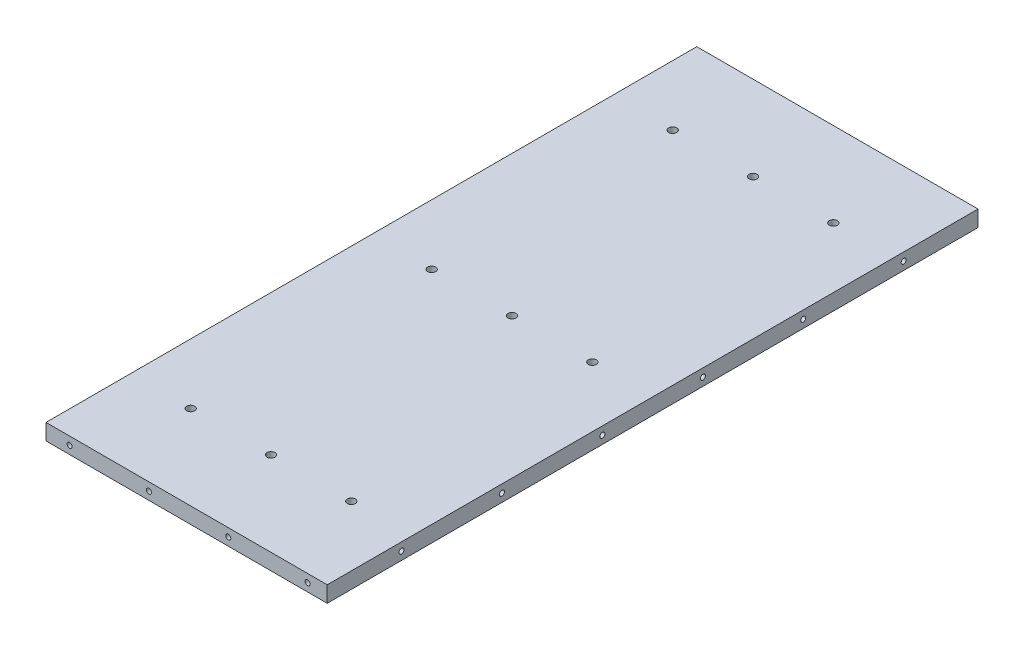
from build123d import *

# Parameters (mm, degrees)
SKETCH1_W                      = 140
SKETCH1_H                      = 324
BOSS_EXTRUDE1_DEPTH            = 8
M3X0_5_TAPPED_HOLE1_AT_2_COUNT = 2
M3X0_5_TAPPED_HOLE1_AT_2_PITCH = 39.5
M3X0_5_TAPPED_HOLE1_AT_3_COUNT = 2
M3X0_5_TAPPED_HOLE1_AT_3_PITCH = 79
M3X0_5_TAPPED_HOLE1_AT_4_COUNT = 2
M3X0_5_TAPPED_HOLE1_AT_4_PITCH = 118.5
M3X0_5_TAPPED_HOLE2_AT_2_COUNT = 2
M3X0_5_TAPPED_HOLE2_AT_2_PITCH = 50
M3X0_5_TAPPED_HOLE2_AT_3_COUNT = 2
M3X0_5_TAPPED_HOLE2_AT_3_PITCH = 100
M3X0_5_TAPPED_HOLE2_AT_4_COUNT = 2
M3X0_5_TAPPED_HOLE2_AT_4_PITCH = 150
M3X0_5_TAPPED_HOLE2_AT_5_COUNT = 2
M3X0_5_TAPPED_HOLE2_AT_5_PITCH = 200
M3X0_5_TAPPED_HOLE2_AT_6_COUNT = 2
M3X0_5_TAPPED_HOLE2_AT_6_PITCH = 250
LPATTERN1_COUNT                = 3
LPATTERN1_PITCH                = 40
LPATTERN1_COUNT_DIR2           = 2
LPATTERN1_PITCH_DIR2           = 120


with BuildPart() as part:
    # Sketch1 → Boss-Extrude1 (new body)
    with BuildSketch(Plane(origin=(0, 0, 0), x_dir=(1, 0, 0), z_dir=(0, 1, 0))):
        Rectangle(SKETCH1_W, SKETCH1_H)
    extrude(amount=BOSS_EXTRUDE1_DEPTH)

    # Sketch5 → M3x0.5 Tapped Hole1 (revolve, cut)
    with BuildSketch(Plane(origin=(60.25, 4, 162), x_dir=(0, -1, 0), z_dir=(1, 0, 0))):
        Polygon((0, 0), (0, 12.251075774), (1.25, 11.5), (1.25, 0), align=None)
    m3x0_5_tapped_hole1 = revolve(axis=Axis((60.25, 4, 168.35), (0, 0, -1)), mode=Mode.SUBTRACT)

    # M3x0.5 Tapped Hole1 at 2: M3x0.5 Tapped Hole1 ×2
    with Locations(*[(-i * M3X0_5_TAPPED_HOLE1_AT_2_PITCH, 0, 0) for i in range(1, M3X0_5_TAPPED_HOLE1_AT_2_COUNT)]):
        add(m3x0_5_tapped_hole1, mode=Mode.SUBTRACT)

    # M3x0.5 Tapped Hole1 at 3: M3x0.5 Tapped Hole1 ×2
    with Locations(*[(-i * M3X0_5_TAPPED_HOLE1_AT_3_PITCH, 0, 0) for i in range(1, M3X0_5_TAPPED_HOLE1_AT_3_COUNT)]):
        add(m3x0_5_tapped_hole1, mode=Mode.SUBTRACT)

    # M3x0.5 Tapped Hole1 at 4: M3x0.5 Tapped Hole1 ×2
    with Locations(*[(-i * M3X0_5_TAPPED_HOLE1_AT_4_PITCH, 0, 0) for i in range(1, M3X0_5_TAPPED_HOLE1_AT_4_COUNT)]):
        add(m3x0_5_tapped_hole1, mode=Mode.SUBTRACT)

    # Sketch7 → M3x0.5 Tapped Hole2 (revolve, cut)
    with BuildSketch(Plane(origin=(-70, 4, -125), x_dir=(0, 0, 1), z_dir=(0, 1, 0))):
        Polygon((0, 0), (0, 12.251075774), (1.25, 11.5), (1.25, 0), align=None)
    m3x0_5_tapped_hole2 = revolve(axis=Axis((-76.35, 4, -125), (1, 0, 0)), mode=Mode.SUBTRACT)

    # M3x0.5 Tapped Hole2 at 2: M3x0.5 Tapped Hole2 ×2
    with Locations(*[(0, 0, i * M3X0_5_TAPPED_HOLE2_AT_2_PITCH) for i in range(1, M3X0_5_TAPPED_HOLE2_AT_2_COUNT)]):
        add(m3x0_5_tapped_hole2, mode=Mode.SUBTRACT)

    # M3x0.5 Tapped Hole2 at 3: M3x0.5 Tapped Hole2 ×2
    with Locations(*[(0, 0, i * M3X0_5_TAPPED_HOLE2_AT_3_PITCH) for i in range(1, M3X0_5_TAPPED_HOLE2_AT_3_COUNT)]):
        add(m3x0_5_tapped_hole2, mode=Mode.SUBTRACT)

    # M3x0.5 Tapped Hole2 at 4: M3x0.5 Tapped Hole2 ×2
    with Locations(*[(0, 0, i * M3X0_5_TAPPED_HOLE2_AT_4_PITCH) for i in range(1, M3X0_5_TAPPED_HOLE2_AT_4_COUNT)]):
        add(m3x0_5_tapped_hole2, mode=Mode.SUBTRACT)

    # M3x0.5 Tapped Hole2 at 5: M3x0.5 Tapped Hole2 ×2
    with Locations(*[(0, 0, i * M3X0_5_TAPPED_HOLE2_AT_5_PITCH) for i in range(1, M3X0_5_TAPPED_HOLE2_AT_5_COUNT)]):
        add(m3x0_5_tapped_hole2, mode=Mode.SUBTRACT)

    # M3x0.5 Tapped Hole2 at 6: M3x0.5 Tapped Hole2 ×2
    with Locations(*[(0, 0, i * M3X0_5_TAPPED_HOLE2_AT_6_PITCH) for i in range(1, M3X0_5_TAPPED_HOLE2_AT_6_COUNT)]):
        add(m3x0_5_tapped_hole2, mode=Mode.SUBTRACT)

    # Mirror1: M3x0.5 Tapped Hole1 across plane
    add(m3x0_5_tapped_hole1.mirror(Plane.XY), mode=Mode.SUBTRACT)

    # Mirror1 copy 1 sketch → Mirror1 copy 1 (revolve, cut)
    with BuildSketch(Plane(origin=(20.75, 4, -162), x_dir=(0, -1, 0), z_dir=(1, 0, 0))):
        Polygon((0, 0), (0, -12.251075774), (1.25, -11.5), (1.25, 0), align=None)
    revolve(axis=Axis((20.75, 4, -168.35), (0, 0, -1)), mode=Mode.SUBTRACT)

    # Mirror1 copy 2 sketch → Mirror1 copy 2 (revolve, cut)
    with BuildSketch(Plane(origin=(-18.75, 4, -162), x_dir=(0, -1, 0), z_dir=(1, 0, 0))):
        Polygon((0, 0), (0, -12.251075774), (1.25, -11.5), (1.25, 0), align=None)
    revolve(axis=Axis((-18.75, 4, -168.35), (0, 0, -1)), mode=Mode.SUBTRACT)

    # Mirror1 copy 3 sketch → Mirror1 copy 3 (revolve, cut)
    with BuildSketch(Plane(origin=(-58.25, 4, -162), x_dir=(0, -1, 0), z_dir=(1, 0, 0))):
        Polygon((0, 0), (0, -12.251075774), (1.25, -11.5), (1.25, 0), align=None)
    revolve(axis=Axis((-58.25, 4, -168.35), (0, 0, -1)), mode=Mode.SUBTRACT)

    # Mirror2: M3x0.5 Tapped Hole2 across plane
    add(m3x0_5_tapped_hole2.mirror(Plane(origin=(0, 0, 0), x_dir=(0, 0, 1), z_dir=(1, 0, 0))), mode=Mode.SUBTRACT)

    # Mirror2 copy 1 sketch → Mirror2 copy 1 (revolve, cut)
    with BuildSketch(Plane(origin=(70, 4, -75), x_dir=(0, 0, 1), z_dir=(0, 1, 0))):
        Polygon((0, 0), (0, -12.251075774), (1.25, -11.5), (1.25, 0), align=None)
    revolve(axis=Axis((76.35, 4, -75), (1, 0, 0)), mode=Mode.SUBTRACT)

    # Mirror2 copy 2 sketch → Mirror2 copy 2 (revolve, cut)
    with BuildSketch(Plane(origin=(70, 4, -25), x_dir=(0, 0, 1), z_dir=(0, 1, 0))):
        Polygon((0, 0), (0, -12.251075774), (1.25, -11.5), (1.25, 0), align=None)
    revolve(axis=Axis((76.35, 4, -25), (1, 0, 0)), mode=Mode.SUBTRACT)

    # Mirror2 copy 3 sketch → Mirror2 copy 3 (revolve, cut)
    with BuildSketch(Plane(origin=(70, 4, 25), x_dir=(0, 0, 1), z_dir=(0, 1, 0))):
        Polygon((0, 0), (0, -12.251075774), (1.25, -11.5), (1.25, 0), align=None)
    revolve(axis=Axis((76.35, 4, 25), (1, 0, 0)), mode=Mode.SUBTRACT)

    # Mirror2 copy 4 sketch → Mirror2 copy 4 (revolve, cut)
    with BuildSketch(Plane(origin=(70, 4, 75), x_dir=(0, 0, 1), z_dir=(0, 1, 0))):
        Polygon((0, 0), (0, -12.251075774), (1.25, -11.5), (1.25, 0), align=None)
    revolve(axis=Axis((76.35, 4, 75), (1, 0, 0)), mode=Mode.SUBTRACT)

    # Mirror2 copy 5 sketch → Mirror2 copy 5 (revolve, cut)
    with BuildSketch(Plane(origin=(70, 4, 125), x_dir=(0, 0, 1), z_dir=(0, 1, 0))):
        Polygon((0, 0), (0, -12.251075774), (1.25, -11.5), (1.25, 0), align=None)
    revolve(axis=Axis((76.35, 4, 125), (1, 0, 0)), mode=Mode.SUBTRACT)

    # Sketch9 → Ø4.0mm Dowel Hole1 (revolve, cut)
    with BuildSketch(Plane(origin=(-40, 8, 0), x_dir=(0, 0, 1), z_dir=(1, 0, 0))):
        Polygon((0, 0), (0, 11.201721238), (2, 10), (2, 0), align=None)
    f_4_0mm_dowel_hole1 = revolve(axis=Axis((-40, 14.35, 0), (0, -1, 0)), mode=Mode.SUBTRACT)

    # LPattern1: 4.0mm Dowel Hole1 3 × 2
    with Locations(*[(i * LPATTERN1_PITCH, 0, j * LPATTERN1_PITCH_DIR2) for i in range(LPATTERN1_COUNT) for j in range(LPATTERN1_COUNT_DIR2) if (i, j) != (0, 0)]):
        add(f_4_0mm_dowel_hole1, mode=Mode.SUBTRACT)

    # Mirror3 copy 1 sketch → Mirror3 copy 1 (revolve, cut)
    with BuildSketch(Plane(origin=(-40, 8, -120), x_dir=(0, 0, -1), z_dir=(1, 0, 0))):
        Polygon((0, 0), (0, -11.201721238), (2, -10), (2, 0), align=None)
    revolve(axis=Axis((-40, 14.35, -120), (0, 1, 0)), mode=Mode.SUBTRACT)

    # Mirror3 copy 2 sketch → Mirror3 copy 2 (revolve, cut)
    with BuildSketch(Plane(origin=(0, 8, 0), x_dir=(0, 0, -1), z_dir=(1, 0, 0))):
        Polygon((0, 0), (0, -11.201721238), (2, -10), (2, 0), align=None)
    revolve(axis=Axis((0, 14.35, 0), (0, 1, 0)), mode=Mode.SUBTRACT)

    # Mirror3 copy 3 sketch → Mirror3 copy 3 (revolve, cut)
    with BuildSketch(Plane(origin=(0, 8, -120), x_dir=(0, 0, -1), z_dir=(1, 0, 0))):
        Polygon((0, 0), (0, -11.201721238), (2, -10), (2, 0), align=None)
    revolve(axis=Axis((0, 14.35, -120), (0, 1, 0)), mode=Mode.SUBTRACT)

    # Mirror3 copy 4 sketch → Mirror3 copy 4 (revolve, cut)
    with BuildSketch(Plane(origin=(40, 8, 0), x_dir=(0, 0, -1), z_dir=(1, 0, 0))):
        Polygon((0, 0), (0, -11.201721238), (2, -10), (2, 0), align=None)
    revolve(axis=Axis((40, 14.35, 0), (0, 1, 0)), mode=Mode.SUBTRACT)

    # Mirror3 copy 5 sketch → Mirror3 copy 5 (revolve, cut)
    with BuildSketch(Plane(origin=(40, 8, -120), x_dir=(0, 0, -1), z_dir=(1, 0, 0))):
        Polygon((0, 0), (0, -11.201721238), (2, -10), (2, 0), align=None)
    revolve(axis=Axis((40, 14.35, -120), (0, 1, 0)), mode=Mode.SUBTRACT)

    # Mirror3 copy 6 sketch → Mirror3 copy 6 (revolve, cut)
    with BuildSketch(Plane(origin=(-40, 8, 0), x_dir=(0, 0, -1), z_dir=(1, 0, 0))):
        Polygon((0, 0), (0, -11.201721238), (2, -10), (2, 0), align=None)
    revolve(axis=Axis((-40, 14.35, 0), (0, 1, 0)), mode=Mode.SUBTRACT)


solid = part.part
